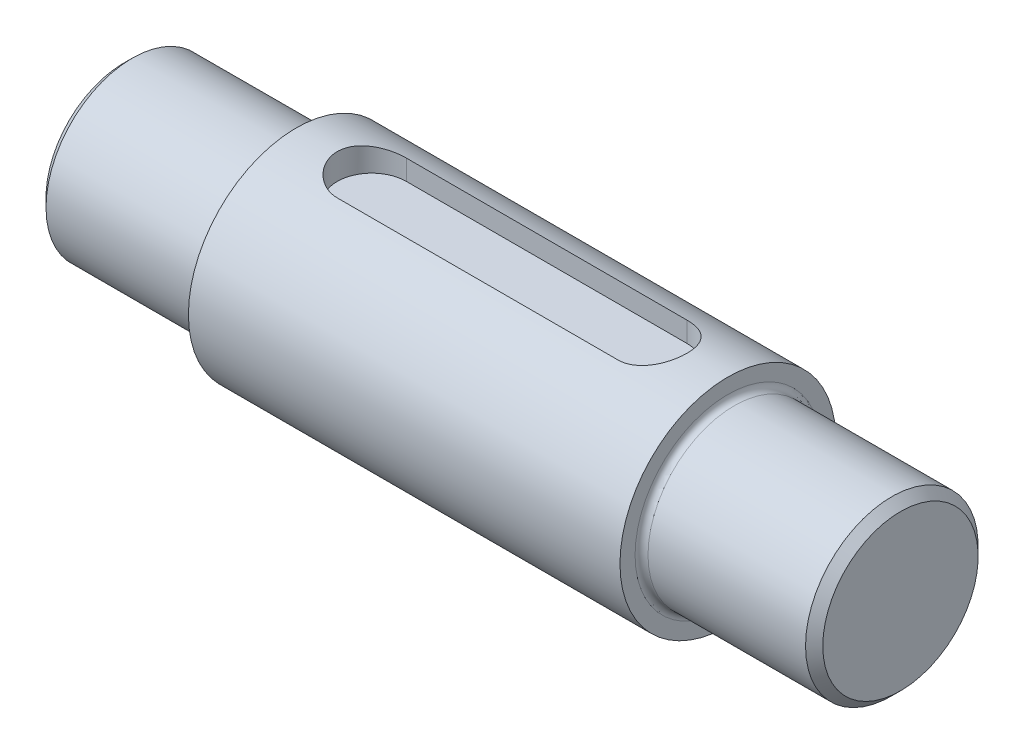
from build123d import *

# Parameters (mm, degrees)
CHANFREIN1_SIZE         = 2
ENL_V_MAT_EXTRU_1_DEPTH = 6


with BuildPart() as part:
    # Esquisse1 → Révolution1 (revolve)
    with BuildSketch(Plane(origin=(0, 0, 0), x_dir=(1, 0, 0), z_dir=(0, 1, 0)), mode=Mode.PRIVATE) as r_volution1_sk:
        with BuildLine():
            Line((-90, 0), (-90, 20))
            Line((-90, 20), (-51.5, 20))
            ThreePointArc((-51.5, 20), (-50.439339828, 20.439339828), (-50, 21.5))
            Line((-50, 21.5), (-50, 25))
            Line((-50, 25), (50, 25))
            Line((50, 25), (50, 21.5))
            ThreePointArc((50, 21.5), (50.439339828, 20.439339828), (51.5, 20))
            Line((51.5, 20), (90, 20))
            Line((90, 20), (90, 0))
            Line((90, 0), (-90, 0))
        make_face()
    revolve(r_volution1_sk.sketch.rotate(Axis((-90, 0, 0), (1, 0, 0)), 180), axis=Axis((-90, 0, 0), (1, 0, 0)))

    # Chanfrein1
    chanfrein1_edges = [part.edges().sort_by_distance(p)[0] for p in [
        (-90, 0, -20),
        (90, 0, -20),
    ]]
    chamfer(chanfrein1_edges, length=CHANFREIN1_SIZE)

    # Esquisse2 → Enlèv. mat.-Extru.1 (cut)
    with BuildSketch(Plane(origin=(0, 25, 0), x_dir=(1, 0, 0), z_dir=(0, 1, 0))):
        with BuildLine():
            Line((-32.5, 8), (32.5, 8))
            ThreePointArc((32.5, 8), (40.5, 0), (32.5, -8))
            Line((32.5, -8), (-32.5, -8))
            ThreePointArc((-32.5, -8), (-40.5, 0), (-32.5, 8))
        make_face()
    extrude(amount=-ENL_V_MAT_EXTRU_1_DEPTH, mode=Mode.SUBTRACT)


solid = part.part
